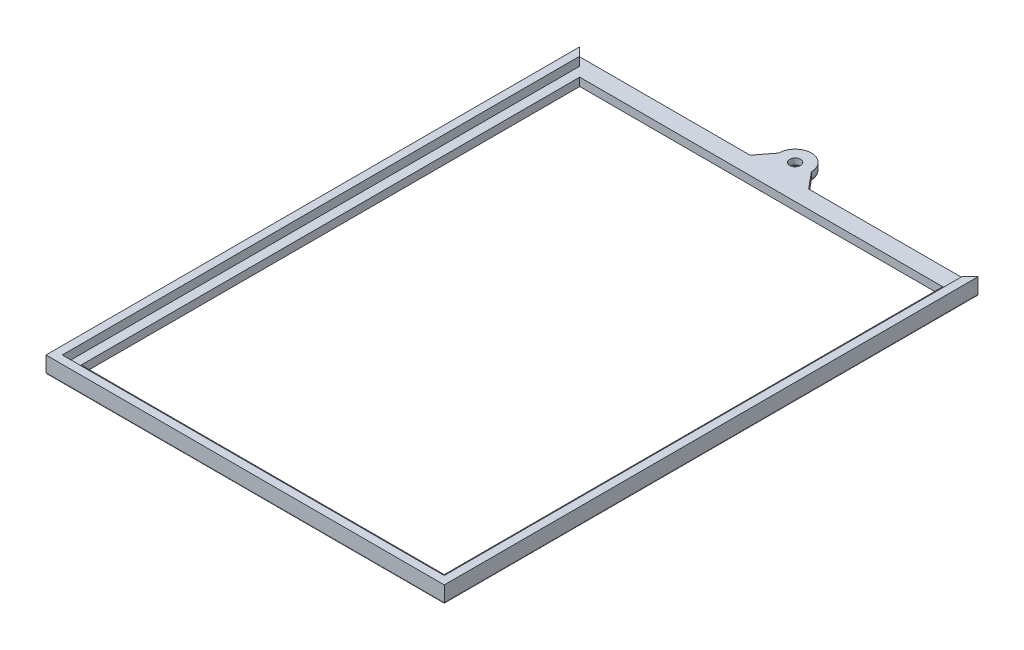
from build123d import *

# Parameters (mm, degrees)
SKETCH_1_R      = 1
SKETCH_1_W      = 67
SKETCH_1_H      = 92
EXTRUDE_1_DEPTH = 1.5
EXTRUDE_2_DEPTH = 1.6
FILLET_1_R      = 0.3
FILLET_2_R      = 0.5


with BuildPart() as part:
    # Эскиз1 → Бобышка-Вытянуть1 (new body)
    with BuildSketch(Plane(origin=(0, 0, 0), x_dir=(1, 0, 0), z_dir=(0, 1, 0))):
        with BuildLine():
            Line((36.75, 49.25), (5.5, 49.25))
            Line((5.5, 49.25), (3, 52.25))
            ThreePointArc((3, 52.25), (0, 55.25), (-3, 52.25))
            Line((-3, 52.25), (-5.300530524, 49.25))
            Line((-5.300530524, 49.25), (-36.75, 49.25))
            Line((-36.75, 49.25), (-36.75, -49.25))
            Line((-36.75, -49.25), (36.75, -49.25))
            Line((36.75, -49.25), (36.75, 49.25))
        make_face()
        with Locations(Location((0, 52.25, 0), (0, 0, 270))):
            Circle(SKETCH_1_R, mode=Mode.SUBTRACT)
        Rectangle(SKETCH_1_W, SKETCH_1_H, mode=Mode.SUBTRACT)
    extrude(amount=EXTRUDE_1_DEPTH)

    # Эскиз2 → Бобышка-Вытянуть2 (add)
    with BuildSketch(Plane(origin=(0, 1.5, 0), x_dir=(1, 0, 0), z_dir=(0, 1, 0))):
        Polygon((35.25, 47.75), (36.75, 49.25), (36.75, -49.25), (-36.75, -49.25), (-36.75, 49.25), (-35.25, 47.75), (-35.25, -47.75), (35.25, -47.75), align=None)
    extrude(amount=EXTRUDE_2_DEPTH)

    # Скругление1
    fillet_1_edges = [part.edges().sort_by_distance(p)[0] for p in [
        (21.125, 0, -49.25),
        (36.75, 0, 0),
        (0, 0, 49.25),
        (-36.75, 0, 0),
        (-21.025265262, 0, -49.25),
        (-4.150265262, 0, -50.75),
        (0, 0, -55.25),
        (4.25, 0, -50.75),
    ]]
    fillet(fillet_1_edges, radius=FILLET_1_R)

    # Скругление2
    fillet_2_edges = [part.edges().sort_by_distance(p)[0] for p in [
        (0, 0, -53.25),
    ]]
    fillet(fillet_2_edges, radius=FILLET_2_R)


solid = part.part
